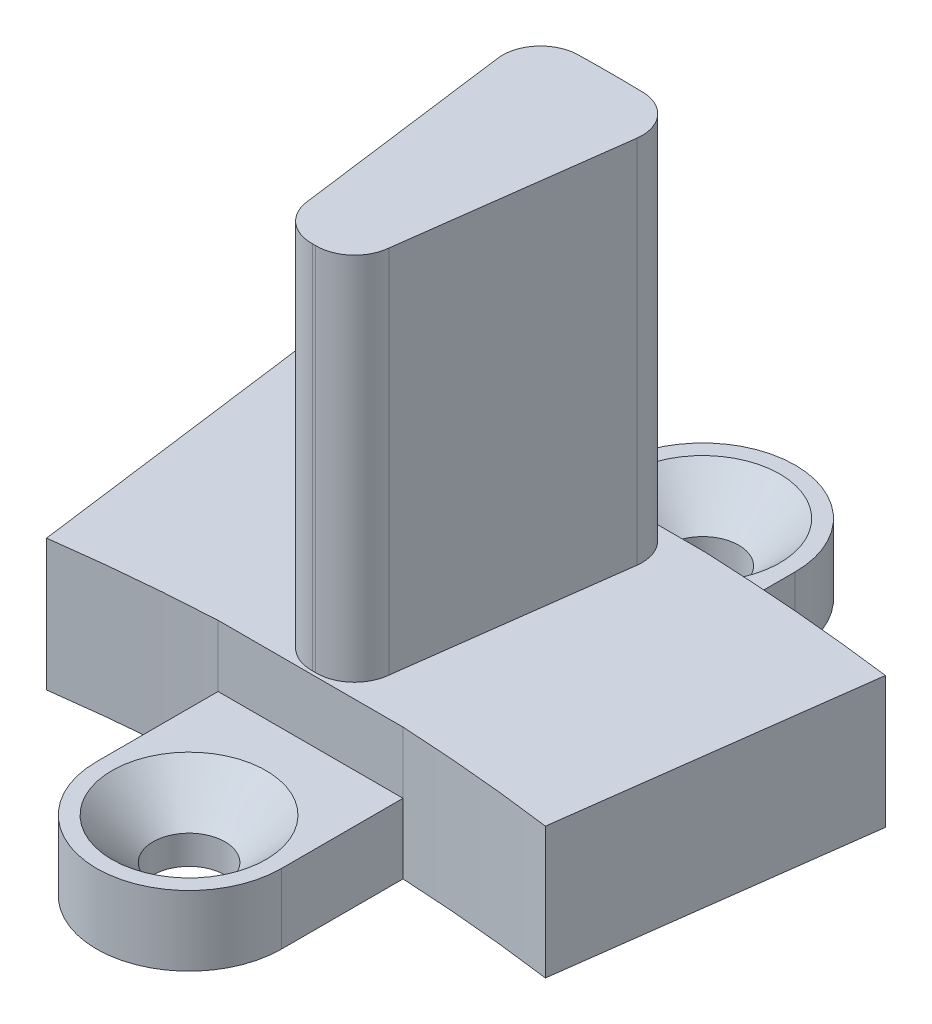
from build123d import *

# Parameters (mm, degrees)
SKETCH1_R                = 1.75
BOSS_EXTRUDE1_DEPTH      = 3.2
BOSS_EXTRUDE2_DEPTH      = 18
BOSS_EXTRUDE2_DEPTH_BACK = 6.4
CUT_EXTRUDE1_DEPTH       = 119.718371128
CUT_EXTRUDE1_DEPTH_BACK  = 3
SKETCH4_R                = 1.75
CHAMFER1_SIZE            = 2


with BuildPart() as part:
    # Sketch1 → Boss-Extrude1 (new, symmetric)
    with BuildSketch(Plane(origin=(0, 0, 0), x_dir=(1, 0, 0), z_dir=(0, 1, 0))):
        with BuildLine():
            Line((-14.064197212, 106.828183813), (-12.138935876, 92.204372108))
            ThreePointArc((-12.138935876, 92.204372108), (-8.327034738, 92.640714043), (-4.5, 92.914191088))
            Line((-4.5, 92.914191088), (-4.5, 90.60548378))
            Line((-4.5, 90.60548378), (-4.5, 89.092083998))
            Line((-4.5, 89.092083998), (-4.5, 87))
            ThreePointArc((-4.5, 87), (0, 82.5), (4.5, 87))
            Line((4.5, 87), (4.5, 89.092083998))
            Line((4.5, 89.092083998), (4.5, 90.60548378))
            Line((4.5, 90.60548378), (4.5, 92.914191088))
            ThreePointArc((4.5, 92.914191088), (8.327034738, 92.640714043), (12.138935876, 92.204372108))
            Line((12.138935876, 92.204372108), (14.064197212, 106.828183813))
            ThreePointArc((14.064197212, 106.828183813), (9.290945642, 107.337913445), (4.5, 107.638902983))
            Line((4.5, 107.638902983), (4.5, 109.907916002))
            Line((4.5, 109.907916002), (4.5, 112))
            ThreePointArc((4.5, 112), (0, 116.5), (-4.5, 112))
            Line((-4.5, 112), (-4.5, 109.907916002))
            Line((-4.5, 109.907916002), (-4.5, 107.638902983))
            ThreePointArc((-4.5, 107.638902983), (-9.290945642, 107.337913445), (-14.064197212, 106.828183813))
        make_face()
        with Locations(Location((0, 112, 0), (0, 0, 270))):
            Circle(SKETCH1_R, mode=Mode.SUBTRACT)
        with Locations(Location((0, 87, 0), (0, 0, 90))):
            Circle(SKETCH1_R, mode=Mode.SUBTRACT)
    extrude(amount=BOSS_EXTRUDE1_DEPTH, both=True)

    # Sketch3 → Boss-Extrude2 (add, two sides: drawn at the far end of the back side and taken through both)
    with BuildSketch(Plane(origin=(0, 3.2, 0), x_dir=(1, 0, 0), z_dir=(0, 1, 0)).offset(-BOSS_EXTRUDE2_DEPTH_BACK)):
        with BuildLine():
            Line((1.966607271, 94.760679154), (3.370522681, 105.424475409))
            ThreePointArc((3.370522681, 105.424475409), (2.956747146, 106.842837192), (1.636401853, 107.505897258))
            ThreePointArc((1.636401853, 107.505897258), (0, 107.524356631), (-1.636401853, 107.505897258))
            ThreePointArc((-1.636401853, 107.505897258), (-2.964387866, 106.850395337), (-3.385996272, 105.430720736))
            Line((-3.385996272, 105.430720736), (-1.982080861, 94.766924481))
            ThreePointArc((-1.982080861, 94.766924481), (-1.356871712, 93.547573592), (-0.06849064, 93.080907451))
            ThreePointArc((-0.06849064, 93.080907451), (0, 93.080930849), (0.06849064, 93.080907451))
            ThreePointArc((0.06849064, 93.080907451), (1.350413288, 93.544661639), (1.966607271, 94.760679154))
        make_face()
    extrude(amount=BOSS_EXTRUDE2_DEPTH + BOSS_EXTRUDE2_DEPTH_BACK)

    # Sketch4 → Cut-Extrude1 (cut, two sides: drawn at the far end of the back side and taken through both)
    # profile 1 of 2: a face of its own
    with BuildSketch(Plane(origin=(0, 3.2, 0), x_dir=(1, 0, 0), z_dir=(0, 1, 0)).offset(-CUT_EXTRUDE1_DEPTH_BACK)):
        with BuildLine():
            Line((-4.5, 91.393652938), (-4.5, 87.032555921))
            ThreePointArc((-4.5, 87.032555921), (0, 82.41632562), (4.5, 87.032555921))
            Line((4.5, 87.032555921), (4.5, 91.393652938))
            Line((4.5, 91.393652938), (4.5, 92.914191088))
            Line((4.5, 92.914191088), (-4.5, 92.914191088))
            Line((-4.5, 92.914191088), (-4.5, 91.393652938))
        make_face()
        with Locations(Location((0, 87, 0), (0, 0, 90))):
            Circle(SKETCH4_R, mode=Mode.SUBTRACT)
    # profile 2 of 2: a face of its own
    with BuildSketch(Plane(origin=(0, 3.2, 0), x_dir=(1, 0, 0), z_dir=(0, 1, 0)).offset(-CUT_EXTRUDE1_DEPTH_BACK)):
        with BuildLine():
            Line((4.5, 107.638902983), (-4.5, 107.638902983))
            Line((-4.5, 107.638902983), (-4.5, 112))
            ThreePointArc((-4.5, 112), (0, 116.5), (4.5, 112))
            Line((4.5, 112), (4.5, 107.638902983))
        make_face()
        with Locations(Location((0, 112, 0), (0, 0, 270))):
            Circle(SKETCH4_R, mode=Mode.SUBTRACT)
    extrude(amount=CUT_EXTRUDE1_DEPTH + CUT_EXTRUDE1_DEPTH_BACK, mode=Mode.SUBTRACT)

    # Chamfer1
    chamfer1_edges = [part.edges().sort_by_distance(p)[0] for p in [
        (0, 0.2, -85.25),
        (0, 0.2, -113.75),
    ]]
    chamfer(chamfer1_edges, length=CHAMFER1_SIZE)


solid = part.part
